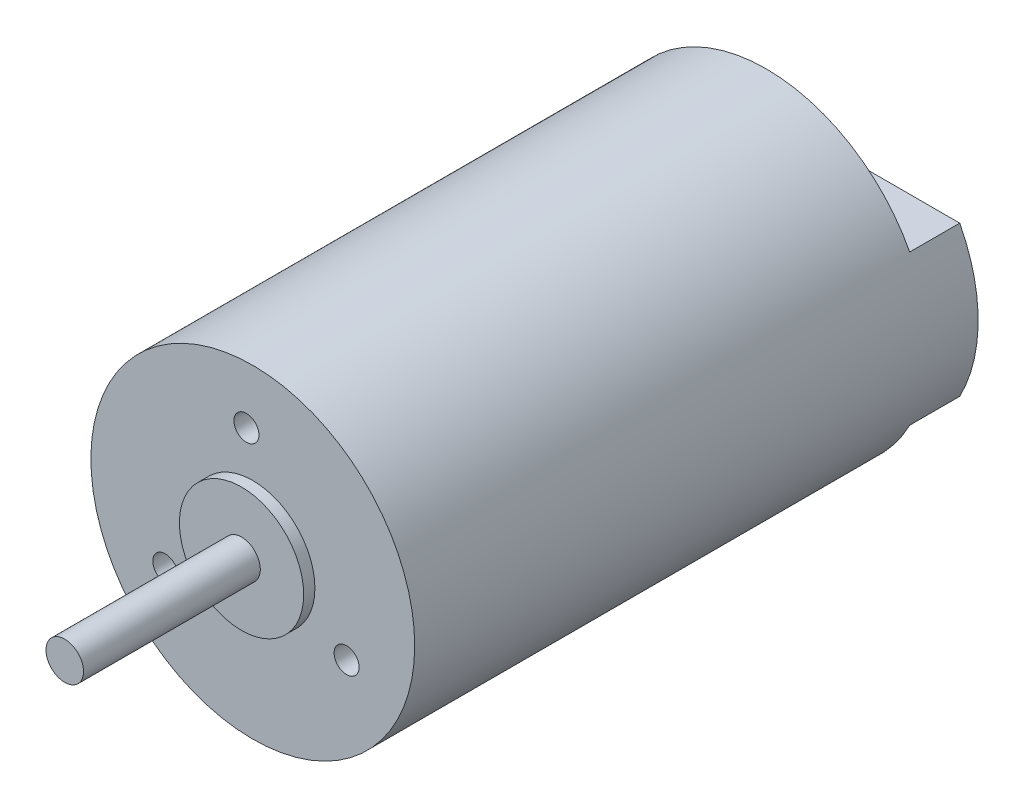
from build123d import *
from build123d.topology import SkipClean

# Parameters (mm, degrees)
SKETCH1_R                    = 12.95
BOSS_EXTRUDE1_DEPTH          = 41.07
SKETCH2_R                    = 4.97
BOSS_EXTRUDE2_DEPTH          = 0.9
SKETCH3_R                    = 1.5
BOSS_EXTRUDE3_DEPTH          = 14.14
F_2_0_2_DIAMETER_HOLE1_D     = 2
F_2_0_2_DIAMETER_HOLE1_DEPTH = 5
F_2_0_2_DIAMETER_HOLE1_TIP   = 0.600860619
BOSS_EXTRUDE4_START          = 4
BOSS_EXTRUDE4_DEPTH          = 4


with BuildPart() as part:
    # Sketch1 → Boss-Extrude1 (new body)
    with BuildSketch(Plane.XY):
        Circle(SKETCH1_R)
    extrude(amount=BOSS_EXTRUDE1_DEPTH)

    # Sketch2 → Boss-Extrude2 (add)
    with BuildSketch(Plane.XY.offset(41.07)):
        Circle(SKETCH2_R)
    extrude(amount=BOSS_EXTRUDE2_DEPTH)

    # Sketch3 → Boss-Extrude3 (add)
    with BuildSketch(Plane.XY.offset(41.97)):
        with Locations(Location((0, 0, 0), (0, 0, 180))):
            Circle(SKETCH3_R)
    extrude(amount=BOSS_EXTRUDE3_DEPTH)

    # Ø2.0 (2) Diameter Hole1
    with Locations(Plane.XY.offset(41.07)):
        with Locations((-0.508072965, 8.361313231), (7.50309849, -3.724675843), (-6.99690151, -4.60576447)):
            Hole(F_2_0_2_DIAMETER_HOLE1_D / 2, depth=F_2_0_2_DIAMETER_HOLE1_DEPTH)
            with Locations((0, 0, -(F_2_0_2_DIAMETER_HOLE1_DEPTH + F_2_0_2_DIAMETER_HOLE1_TIP / 2))):  # 118° drill point
                Cone(0, F_2_0_2_DIAMETER_HOLE1_D / 2, F_2_0_2_DIAMETER_HOLE1_TIP, mode=Mode.SUBTRACT)

    # Sketch6 → Boss-Extrude4 (add)
    with SkipClean():  # the faces are left unmerged after this step: merging them gives an invalid solid
        with BuildSketch(Plane(origin=(0, 0, 0), x_dir=(-1, 0, 0), z_dir=(0, 0, -1)).offset(BOSS_EXTRUDE4_START)):
            with BuildLine():
                ThreePointArc((-11.476170964, 6), (-12.95, 0), (-11.476170964, -6))
                Line((-11.476170964, -6), (11.476170964, -6))
                ThreePointArc((11.476170964, -6), (12.576146349, -3.089181608), (12.95, 0))
                ThreePointArc((12.95, 0), (12.576146349, 3.089181608), (11.476170964, 6))
                Line((11.476170964, 6), (-11.476170964, 6))
            make_face()
        extrude(amount=-BOSS_EXTRUDE4_DEPTH)


solid = part.part
